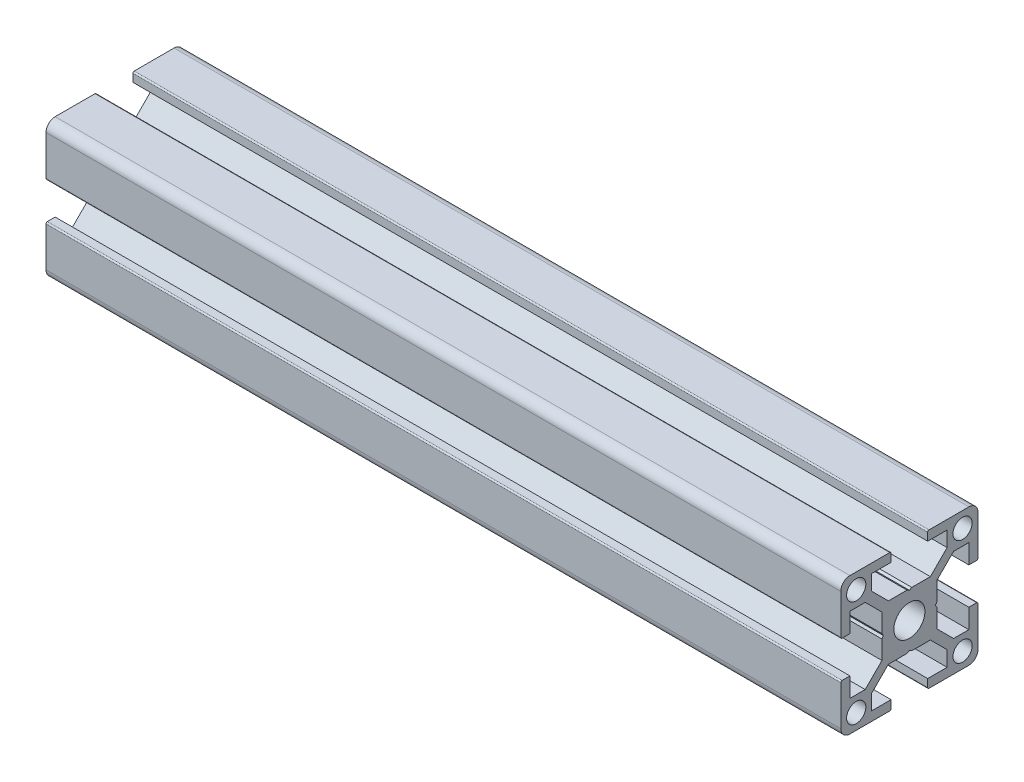
from build123d import *

# Parameters (mm, degrees)
SKETCH_1_R              = 2.1
SKETCH_1_R_2            = 3.4
F_30XS6_30X30S6_1_DEPTH = 173.76


with BuildPart() as part:
    # 草图1 → 30xs6 30X30S6(1) (new body)
    with BuildSketch(Plane.YZ):
        with BuildLine():
            Line((-14.7, 4), (-13, 4))
            Line((-13, 4), (-13, 8.25))
            Line((-13, 8.25), (-9.664213562, 8.25))
            Line((-9.664213562, 8.25), (-6, 4.585786438))
            Line((-6, 4.585786438), (-6, 0.519615242))
            Line((-6, 0.519615242), (-5.7, 0))
            Line((-5.7, 0), (-6, -0.519615242))
            Line((-6, -0.519615242), (-6, -4.585786438))
            Line((-6, -4.585786438), (-9.664213562, -8.25))
            Line((-9.664213562, -8.25), (-13, -8.25))
            Line((-13, -8.25), (-13, -4))
            Line((-13, -4), (-14.7, -4))
            ThreePointArc((-14.7, -4), (-14.912132034, -4.087867966), (-15, -4.3))
            Line((-15, -4.3), (-15, -13))
            ThreePointArc((-15, -13), (-14.414213562, -14.414213562), (-13, -15))
            Line((-13, -15), (-4.3, -15))
            ThreePointArc((-4.3, -15), (-4.087867966, -14.912132034), (-4, -14.7))
            Line((-4, -14.7), (-4, -13))
            Line((-4, -13), (-8.25, -13))
            Line((-8.25, -13), (-8.25, -9.664213562))
            Line((-8.25, -9.664213562), (-4.585786438, -6))
            Line((-4.585786438, -6), (-0.519615242, -6))
            Line((-0.519615242, -6), (0, -5.7))
            Line((0, -5.7), (0.519615242, -6))
            Line((0.519615242, -6), (4.585786438, -6))
            Line((4.585786438, -6), (8.25, -9.664213562))
            Line((8.25, -9.664213562), (8.25, -13))
            Line((8.25, -13), (4, -13))
            Line((4, -13), (4, -14.7))
            ThreePointArc((4, -14.7), (4.087867966, -14.912132034), (4.3, -15))
            Line((4.3, -15), (13, -15))
            ThreePointArc((13, -15), (14.414213562, -14.414213562), (15, -13))
            Line((15, -13), (15, -4.3))
            ThreePointArc((15, -4.3), (14.912132034, -4.087867966), (14.7, -4))
            Line((14.7, -4), (13, -4))
            Line((13, -4), (13, -8.25))
            Line((13, -8.25), (9.664213562, -8.25))
            Line((9.664213562, -8.25), (6, -4.585786438))
            Line((6, -4.585786438), (6, -0.519615242))
            Line((6, -0.519615242), (5.7, 0))
            Line((5.7, 0), (6, 0.519615242))
            Line((6, 0.519615242), (6, 4.585786438))
            Line((6, 4.585786438), (9.664213562, 8.25))
            Line((9.664213562, 8.25), (13, 8.25))
            Line((13, 8.25), (13, 4))
            Line((13, 4), (14.7, 4))
            ThreePointArc((14.7, 4), (14.912132034, 4.087867966), (15, 4.3))
            Line((15, 4.3), (15, 13))
            ThreePointArc((15, 13), (14.414213562, 14.414213562), (13, 15))
            Line((13, 15), (4.3, 15))
            ThreePointArc((4.3, 15), (4.087867966, 14.912132034), (4, 14.7))
            Line((4, 14.7), (4, 13))
            Line((4, 13), (8.25, 13))
            Line((8.25, 13), (8.25, 9.664213562))
            Line((8.25, 9.664213562), (4.585786438, 6))
            Line((4.585786438, 6), (0.519615242, 6))
            Line((0.519615242, 6), (0, 5.7))
            Line((0, 5.7), (-0.519615242, 6))
            Line((-0.519615242, 6), (-4.585786438, 6))
            Line((-4.585786438, 6), (-8.25, 9.664213562))
            Line((-8.25, 9.664213562), (-8.25, 13))
            Line((-8.25, 13), (-4, 13))
            Line((-4, 13), (-4, 14.7))
            ThreePointArc((-4, 14.7), (-4.087867966, 14.912132034), (-4.3, 15))
            Line((-4.3, 15), (-13, 15))
            ThreePointArc((-13, 15), (-14.414213562, 14.414213562), (-15, 13))
            Line((-15, 13), (-15, 4.3))
            ThreePointArc((-15, 4.3), (-14.912132034, 4.087867966), (-14.7, 4))
        make_face()
        with Locations((11.625, 11.625)):
            Circle(SKETCH_1_R, mode=Mode.SUBTRACT)
        with Locations((11.625, -11.625)):
            Circle(SKETCH_1_R, mode=Mode.SUBTRACT)
        Circle(SKETCH_1_R_2, mode=Mode.SUBTRACT)
        with Locations((-11.625, -11.625)):
            Circle(SKETCH_1_R, mode=Mode.SUBTRACT)
        with Locations((-11.625, 11.625)):
            Circle(SKETCH_1_R, mode=Mode.SUBTRACT)
    extrude(amount=F_30XS6_30X30S6_1_DEPTH)


solid = part.part
